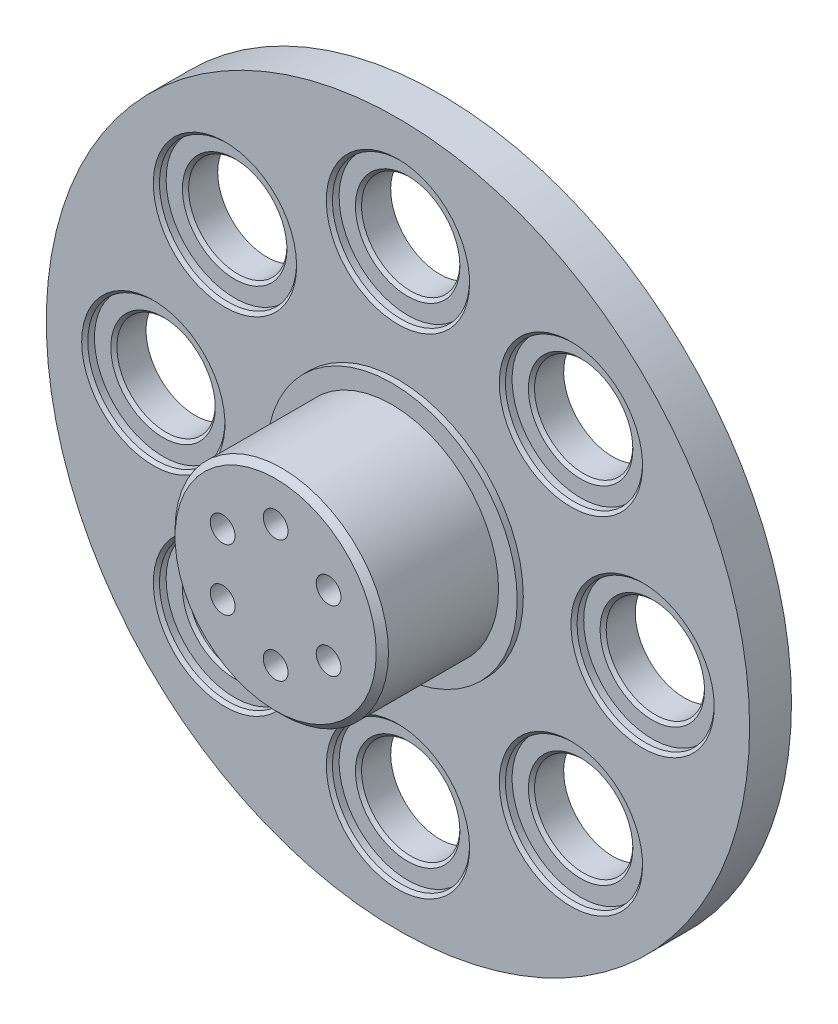
from build123d import *

# Parameters (mm, degrees)
SKETCH1_R                    = 17.45
BOSS_EXTRUDE1_DEPTH          = 19
SKETCH7_R                    = 20.5
BOSS_EXTRUDE3_DEPTH          = 1
SKETCH3_R                    = 57.5
BOSS_EXTRUDE2_DEPTH          = 6.85
SKETCH4_R                    = 11.075
CUT_EXTRUDE1_DEPTH           = 7
SKETCH5_R                    = 7.5
CUT_EXTRUDE2_DEPTH           = 0.5
SKETCH6_R                    = 2.025
CUT_EXTRUDE3_DEPTH           = 10
CIRPATTERN1_COUNT            = 6
CHAMFER1_SIZE                = 1
SKETCH8_R                    = 8.04
CUT_EXTRUDE4_DEPTH           = 84.740671122
SKETCH9_R                    = 11.2125
CUT_EXTRUDE5_DEPTH           = 1.5875
CHAMFER2_SIZE                = 0.5
CHAMFER3_SIZE                = 0.5
CIRPATTERN2_COUNT            = 8
CHAMFER2_OF_CIRPATTERN2_SIZE = 0.5
CHAMFER3_OF_CIRPATTERN2_SIZE = 0.5


with BuildPart() as part:
    # Sketch1 → Boss-Extrude1 (new body)
    with BuildSketch(Plane.XY):
        Circle(SKETCH1_R)
    extrude(amount=BOSS_EXTRUDE1_DEPTH)

    # Sketch7 → Boss-Extrude3 (add)
    with BuildSketch(Plane(origin=(0, 0, 0), x_dir=(-1, 0, 0), z_dir=(0, 0, -1))):
        Circle(SKETCH7_R)
    extrude(amount=BOSS_EXTRUDE3_DEPTH)

    # Sketch3 → Boss-Extrude2 (add)
    with BuildSketch(Plane(origin=(0, 0, -1), x_dir=(-1, 0, 0), z_dir=(0, 0, -1))):
        Circle(SKETCH3_R)
    extrude(amount=BOSS_EXTRUDE2_DEPTH)

    # Sketch4 → Cut-Extrude1 (cut)
    with BuildSketch(Plane(origin=(0, 0, -7.85), x_dir=(-1, 0, 0), z_dir=(0, 0, -1))):
        Circle(SKETCH4_R)
    extrude(amount=-CUT_EXTRUDE1_DEPTH, mode=Mode.SUBTRACT)

    # Sketch5 → Cut-Extrude2 (cut)
    with BuildSketch(Plane(origin=(0, 0, -0.85), x_dir=(-1, 0, 0), z_dir=(0, 0, -1))):
        Circle(SKETCH5_R)
    extrude(amount=-CUT_EXTRUDE2_DEPTH, mode=Mode.SUBTRACT)

    # Sketch6 → Cut-Extrude3 (cut)
    with BuildSketch(Plane.XY.offset(19)):
        with Locations((0, 10)):
            Circle(SKETCH6_R)
    cut_extrude3 = extrude(amount=-CUT_EXTRUDE3_DEPTH, mode=Mode.SUBTRACT)

    # CirPattern1: Cut-Extrude3 ×6 about axis
    cirpattern1_axis = Axis((0, 0, 19), (0, 0, 1))
    for i in range(1, CIRPATTERN1_COUNT):
        add(cut_extrude3.rotate(cirpattern1_axis, i * 360 / CIRPATTERN1_COUNT), mode=Mode.SUBTRACT)

    # Chamfer1
    chamfer1_edges = [part.edges().sort_by_distance(p)[0] for p in [
        (11.075, 0, -7.85),
        (-17.45, 0, 19),
    ]]
    chamfer(chamfer1_edges, length=CHAMFER1_SIZE)

    # Sketch8 → Cut-Extrude4 (cut, through all)
    with BuildSketch(Plane.XY.offset(-1)):
        with Locations((-40, 0)):
            Circle(SKETCH8_R)
    cut_extrude4 = extrude(amount=-CUT_EXTRUDE4_DEPTH, mode=Mode.SUBTRACT)

    # Sketch9 → Cut-Extrude5 (cut)
    with BuildSketch(Plane.XY.offset(-1)):
        with Locations((-40, 0)):
            Circle(SKETCH9_R)
    cut_extrude5 = extrude(amount=-CUT_EXTRUDE5_DEPTH, mode=Mode.SUBTRACT)

    # Chamfer2
    chamfer2_edges = [part.edges().sort_by_distance(p)[0] for p in [
        (-48.04, 0, -2.5875),
    ]]
    chamfer(chamfer2_edges, length=CHAMFER2_SIZE)

    # Chamfer3
    chamfer3_edges = [part.edges().sort_by_distance(p)[0] for p in [
        (-51.2125, 0, -1),
    ]]
    chamfer(chamfer3_edges, length=CHAMFER3_SIZE)

    # CirPattern2: Cut-Extrude4, Cut-Extrude5 ×8 about axis
    cirpattern2_axis = Axis((0, 0, -1), (0, 0, -1))
    add([cut_extrude4.rotate(cirpattern2_axis, i * 360 / CIRPATTERN2_COUNT) for i in range(1, CIRPATTERN2_COUNT)], mode=Mode.SUBTRACT)
    add([cut_extrude5.rotate(cirpattern2_axis, i * 360 / CIRPATTERN2_COUNT) for i in range(1, CIRPATTERN2_COUNT)], mode=Mode.SUBTRACT)

    # Chamfer2 of CirPattern2
    chamfer2_of_cirpattern2_edges = [part.edges().sort_by_distance(p)[0] for p in [
        (-33.969409768, 33.969409768, -2.5875),
        (0, 48.04, -2.5875),
        (33.969409768, 33.969409768, -2.5875),
        (48.04, 0, -2.5875),
        (33.969409768, -33.969409768, -2.5875),
        (0, -48.04, -2.5875),
        (-33.969409768, -33.969409768, -2.5875),
    ]]
    chamfer(chamfer2_of_cirpattern2_edges, length=CHAMFER2_OF_CIRPATTERN2_SIZE)

    # Chamfer3 of CirPattern2
    chamfer3_of_cirpattern2_edges = [part.edges().sort_by_distance(p)[0] for p in [
        (-36.212706032, 36.212706032, -1),
        (0, 51.2125, -1),
        (36.212706032, 36.212706032, -1),
        (51.2125, 0, -1),
        (36.212706032, -36.212706032, -1),
        (0, -51.2125, -1),
        (-36.212706032, -36.212706032, -1),
    ]]
    chamfer(chamfer3_of_cirpattern2_edges, length=CHAMFER3_OF_CIRPATTERN2_SIZE)


solid = part.part
